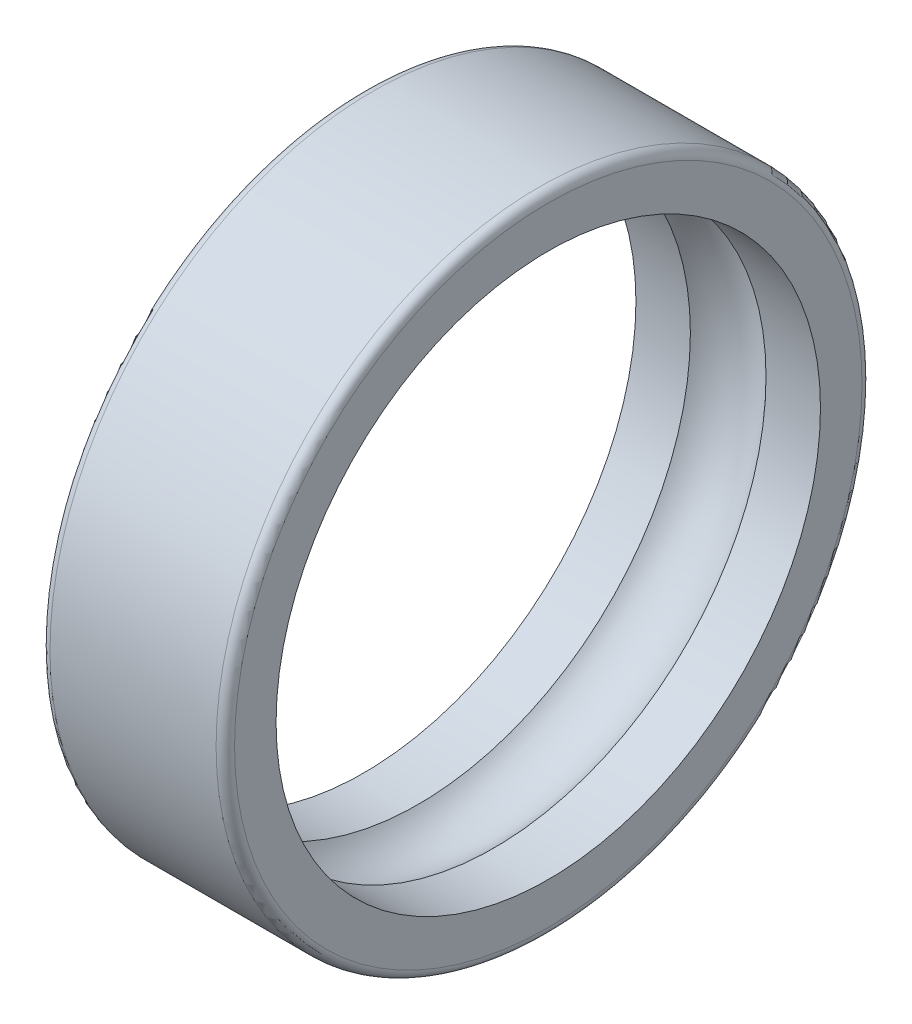
from build123d import *


with BuildPart() as part:
    # Esquisse1 → Base-Révolution (revolve)
    with BuildSketch(Plane(origin=(0, 0, 0), x_dir=(1, 0, 0), z_dir=(0, 1, 0))):
        with BuildLine():
            Line((0, 20.4), (0, 17.7))
            Line((0, 17.7), (3.540325225, 17.7))
            ThreePointArc((3.540325225, 17.7), (6, 18.8), (8.459674775, 17.7))
            Line((8.459674775, 17.7), (12, 17.7))
            Line((12, 17.7), (12, 20.4))
            ThreePointArc((12, 20.4), (11.824264069, 20.824264069), (11.4, 21))
            Line((11.4, 21), (0.6, 21))
            ThreePointArc((0.6, 21), (0.175735931, 20.824264069), (0, 20.4))
        make_face()
    revolve(axis=Axis((0, 0, 0), (1, 0, 0)))


solid = part.part
